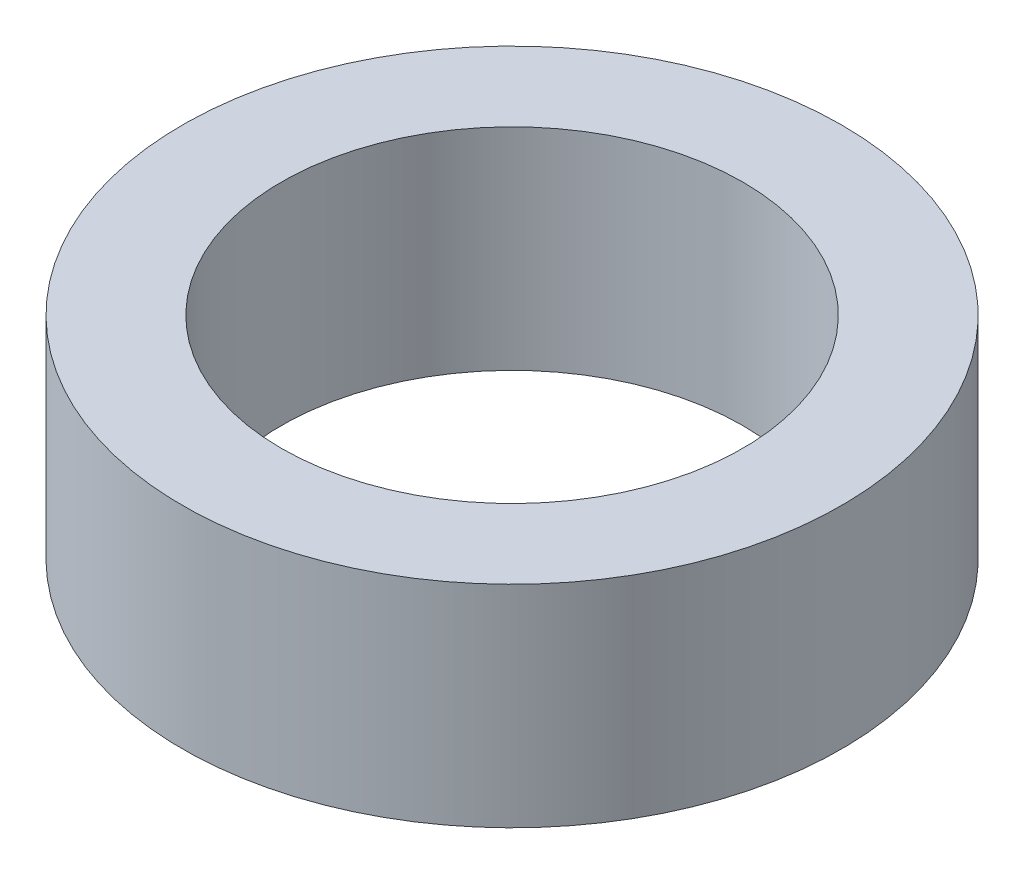
from build123d import *

# Parameters (mm, degrees)
SKETCH1_W = 9.525
SKETCH1_H = 20.32


with BuildPart() as part:
    # Sketch1 → Revolve1 (revolve)
    with BuildSketch(Plane.XY, mode=Mode.PRIVATE) as revolve1_sk:
        with Locations((26.9875, 10.16)):
            Rectangle(SKETCH1_W, SKETCH1_H)
    revolve(revolve1_sk.sketch.rotate(Axis((0, 0, 0), (0, 1, 0)), 90), axis=Axis((0, 0, 0), (0, 1, 0)))


solid = part.part
